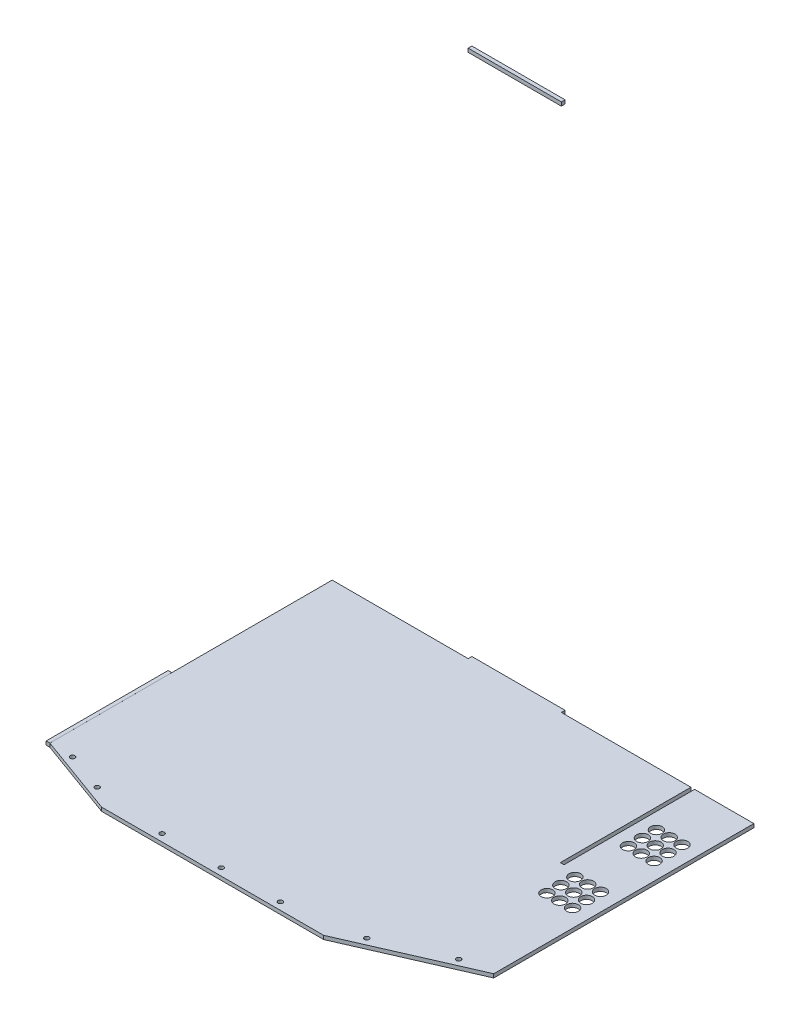
from build123d import *

# Parameters (mm, degrees)
SKETCH1_W           = 308.1112
SKETCH1_H           = 3.175
BOSS_EXTRUDE1_DEPTH = 267.83
SKETCH3_W           = 155.702
SKETCH3_H           = 3.175
BOSS_EXTRUDE3_DEPTH = 3.175
SKETCH4_W           = 50.87366
SKETCH4_H           = 3.175
BOSS_EXTRUDE4_DEPTH = 267.83
CUT_EXTRUDE1_DEPTH  = 340.190761306
CUT_EXTRUDE3_DEPTH  = 340.190761306
SKETCH13_R          = 5
CUT_EXTRUDE4_DEPTH  = 340.190761306
LPATTERN1_COUNT     = 3
LPATTERN1_PITCH     = 12
SKETCH17_W          = 104.775
SKETCH17_H          = 3.175
BOSS_EXTRUDE5_DEPTH = 3.175
SKETCH18_W          = 80
SKETCH18_H          = 3.175
BOSS_EXTRUDE6_DEPTH = 3.175
SKETCH19_W          = 80
SKETCH19_H          = 3.175
BOSS_EXTRUDE7_DEPTH = 3.175
SKETCH20_R          = 2
CUT_EXTRUDE5_DEPTH  = 3.175


with BuildPart() as part:
    # Sketch1 → Boss-Extrude1 (new body)
    with BuildSketch(Plane.XY):
        Rectangle(SKETCH1_W, SKETCH1_H)
    extrude(amount=BOSS_EXTRUDE1_DEPTH)

    # Sketch3 → Boss-Extrude3 (add)
    with BuildSketch(Plane(origin=(154.0556, 0, 0), x_dir=(0, 0, -1), z_dir=(1, 0, 0))):
        with Locations((-189.979, 0)):
            Rectangle(SKETCH3_W, SKETCH3_H)
    extrude(amount=BOSS_EXTRUDE3_DEPTH)

    # Sketch4 → Boss-Extrude4 (add)
    with BuildSketch(Plane.XY.offset(267.83)):
        with Locations((182.66743, 0)):
            Rectangle(SKETCH4_W, SKETCH4_H)
    extrude(amount=-BOSS_EXTRUDE4_DEPTH)

    # Sketch6 → Cut-Extrude1 (cut, through all)
    with BuildSketch(Plane(origin=(0, 1.5875, 0), x_dir=(1, 0, 0), z_dir=(0, 1, 0))):
        Polygon((208.10426, -223.38), (106.50426, -267.83), (208.10426, -267.83), align=None)
    extrude(amount=-CUT_EXTRUDE1_DEPTH, mode=Mode.SUBTRACT)

    # Sketch11 → Cut-Extrude3 (cut, through all)
    with BuildSketch(Plane.XZ.offset(1.5875)):
        Polygon((-154.0556, 242.43), (-84.2056, 267.83), (-154.0556, 267.83), align=None)
    extrude(amount=-CUT_EXTRUDE3_DEPTH, mode=Mode.SUBTRACT)

    # Sketch13 → Cut-Extrude4 (cut, through all)
    with BuildSketch(Plane.XZ.offset(1.5875)):
        with Locations(Location((171.04991, 116.644763656, 0), (0, 0, 270))):
            Circle(SKETCH13_R)
        with Locations(Location((182.04991, 116.644763656, 0), (0, 0, 270))):
            Circle(SKETCH13_R)
        with Locations(Location((193.04991, 116.644763656, 0), (0, 0, 270))):
            Circle(SKETCH13_R)
        with Locations(Location((171.04991, 46.644823778, 0), (0, 0, 270))):
            Circle(SKETCH13_R)
        with Locations(Location((182.04991, 46.644823778, 0), (0, 0, 270))):
            Circle(SKETCH13_R)
        with Locations(Location((193.04991, 46.644823778, 0), (0, 0, 270))):
            Circle(SKETCH13_R)
    cut_extrude4 = extrude(amount=-CUT_EXTRUDE4_DEPTH, mode=Mode.SUBTRACT)

    # LPattern1: Cut-Extrude4 ×3
    with Locations(*[(0, 0, i * LPATTERN1_PITCH) for i in range(1, LPATTERN1_COUNT)]):
        add(cut_extrude4, mode=Mode.SUBTRACT)

    # Sketch17 → Boss-Extrude5 (add)
    with BuildSketch(Plane.ZY.offset(154.0556)):
        with Locations((190.037500036, 0.0104967)):
            Rectangle(SKETCH17_W, SKETCH17_H)
    extrude(amount=BOSS_EXTRUDE5_DEPTH)

    # Sketch18 → Boss-Extrude6 (add)
    with BuildSketch(Plane(origin=(0, 0, 0), x_dir=(-1, 0, 0), z_dir=(0, 0, -1))):
        with Locations((-2.78399998, 0)):
            Rectangle(SKETCH18_W, SKETCH18_H)
    extrude(amount=BOSS_EXTRUDE6_DEPTH)

    # Sketch20 → Cut-Extrude5 (cut)
    with BuildSketch(Plane.XZ.offset(1.5875)):
        with Locations(Location((182.243124242, 227.637356871, 0), (0, 0, 270))):
            Circle(SKETCH20_R)
        with Locations(Location((127.164589763, 251.436632224, 0), (0, 0, 270))):
            Circle(SKETCH20_R)
        with Locations(Location((63.04949858, 261.511588172, 0), (0, 0, 270))):
            Circle(SKETCH20_R)
        with Locations(Location((12.24949858, 261.511588172, 0), (0, 0, 270))):
            Circle(SKETCH20_R)
        with Locations(Location((-38.55050142, 261.511588172, 0), (0, 0, 270))):
            Circle(SKETCH20_R)
        with Locations(Location((-100.903566138, 255.00138282, 0), (0, 0, 270))):
            Circle(SKETCH20_R)
        with Locations(Location((-133.982946832, 242.972517113, 0), (0, 0, 270))):
            Circle(SKETCH20_R)
    extrude(amount=-CUT_EXTRUDE5_DEPTH, mode=Mode.SUBTRACT)


with BuildPart() as body_2:
    # Sketch19 → Boss-Extrude7 (new body)
    with BuildSketch(Plane(origin=(0, 0, 0), x_dir=(-1, 0, 0), z_dir=(0, 0, -1))):
        with Locations((-2.78399998, 454.048)):
            Rectangle(SKETCH19_W, SKETCH19_H)
    extrude(amount=BOSS_EXTRUDE7_DEPTH)


solid = Compound([part.part, body_2.part])
